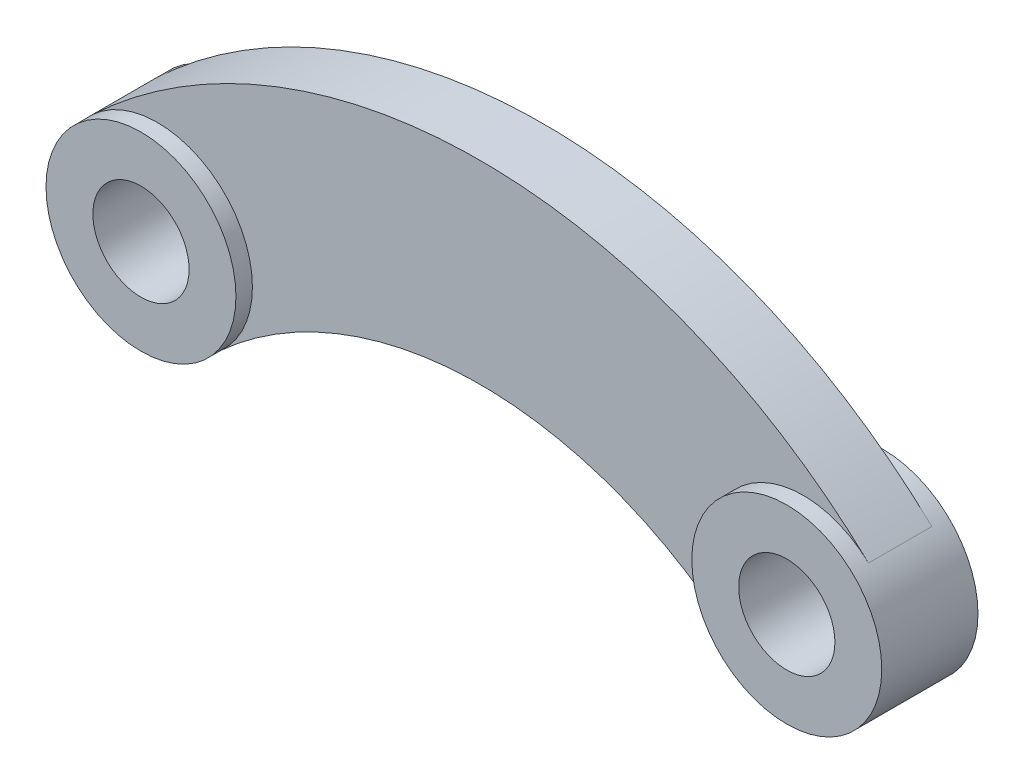
from build123d import *

# Parameters (mm, degrees)
SKETCH1_R           = 38
BOSS_EXTRUDE1_DEPTH = 25
SKETCH2_R           = 75
SKETCH2_R_2         = 38
BOSS_EXTRUDE2_DEPTH = 38


with BuildPart() as part:
    # Sketch1 → Boss-Extrude1 (new, symmetric)
    with BuildSketch(Plane.XY):
        with BuildLine():
            ThreePointArc((-51.549865229, 54.475787235), (-55.04414314, -50.942539257), (50.328947368, -55.605728633))
            ThreePointArc((50.328947368, -55.605728633), (255, 23.26430826), (459.671052632, -55.605728633))
            ThreePointArc((459.671052632, -55.605728633), (565.04414314, -50.942539257), (561.549865229, 54.475787235))
            ThreePointArc((561.549865229, 54.475787235), (255, 176.526439145), (-51.549865229, 54.475787235))
        make_face()
        Circle(SKETCH1_R, mode=Mode.SUBTRACT)
        with Locations((510, 0)):
            Circle(SKETCH1_R, mode=Mode.SUBTRACT)
    extrude(amount=BOSS_EXTRUDE1_DEPTH, both=True)

    # Sketch2 → Boss-Extrude2 (add, symmetric)
    # profile 1 of 2: a face of its own
    with BuildSketch(Plane.XY):
        Circle(SKETCH2_R)
        Circle(SKETCH2_R_2, mode=Mode.SUBTRACT)
    # profile 2 of 2: a face of its own
    with BuildSketch(Plane.XY):
        with Locations((510, 0)):
            Circle(SKETCH2_R)
        with Locations((510, 0)):
            Circle(SKETCH2_R_2, mode=Mode.SUBTRACT)
    extrude(amount=BOSS_EXTRUDE2_DEPTH, both=True)


solid = part.part
